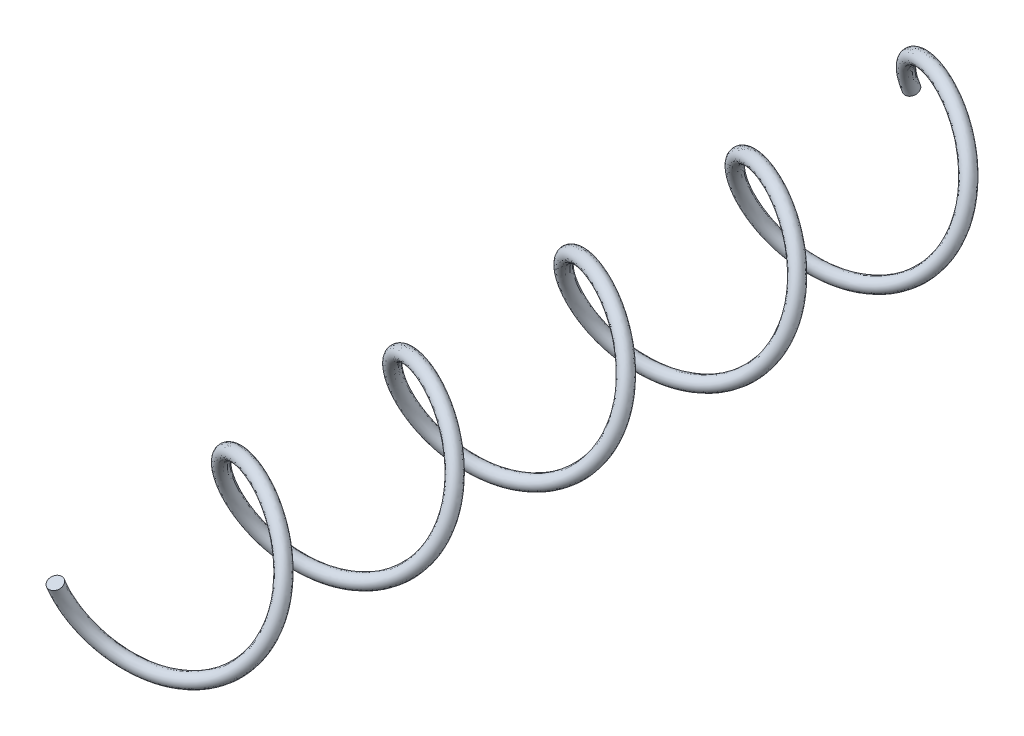
from build123d import *

# Parameters (mm, degrees)
BALAYAGE1_PITCH       = 50
BALAYAGE1_HEIGHT      = 250
BALAYAGE1_RADIUS      = 20
BALAYAGE1_START_ANGLE = -180
BALAYAGE1_PROFILE_R   = 2


with BuildPart() as part:
    # Balayage1: sweep along a helix
    with BuildLine() as balayage1_path:
        add(Helix(BALAYAGE1_PITCH, BALAYAGE1_HEIGHT, BALAYAGE1_RADIUS, center=(0, 0, 0), direction=(0, 0, 1), lefthand=True, mode=Mode.PRIVATE).rotate(Axis((0, 0, 0), (0, 0, 1)), BALAYAGE1_START_ANGLE))
    # Balayage1 profile (on start of the path) → Balayage1 (sweep)
    with BuildSketch(Plane(origin=(-20, 0, 0), x_dir=(0, -0.3696978475698628, 0.9291520335780418), z_dir=(2.6129274859105733e-13, 0.9291520335780418, 0.3696978475698628))):
        Circle(BALAYAGE1_PROFILE_R)
    sweep(path=balayage1_path.line, is_frenet=True)


solid = part.part
